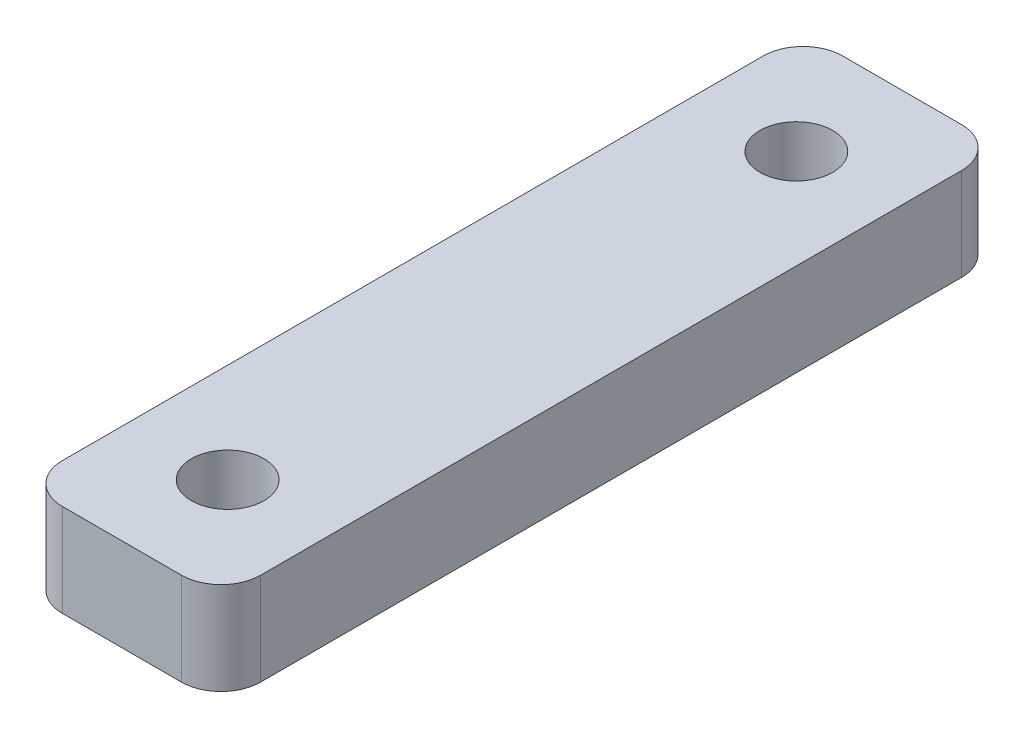
from build123d import *

# Parameters (mm, degrees)
SKETCH1_R           = 2.75
BOSS_EXTRUDE1_DEPTH = 7


with BuildPart() as part:
    # Sketch1 → Boss-Extrude1 (new body)
    with BuildSketch(Plane(origin=(0, 0, 0), x_dir=(1, 0, 0), z_dir=(0, 1, 0))):
        with BuildLine():
            Line((0, 0), (0, 53))
            ThreePointArc((0, 53), (0.878679656, 55.121320344), (3, 56))
            Line((3, 56), (12, 56))
            ThreePointArc((12, 56), (14.121320344, 55.121320344), (15, 53))
            Line((15, 53), (15, 0))
            ThreePointArc((15, 0), (14.121320344, -2.121320344), (12, -3))
            Line((12, -3), (3, -3))
            ThreePointArc((3, -3), (0.878679656, -2.121320344), (0, 0))
        make_face()
        with Locations(Location((7.5, 48, 0), (0, 0, 270))):
            Circle(SKETCH1_R, mode=Mode.SUBTRACT)
        with Locations(Location((7.5, 5, 0), (0, 0, 270))):
            Circle(SKETCH1_R, mode=Mode.SUBTRACT)
    extrude(amount=BOSS_EXTRUDE1_DEPTH)


solid = part.part
